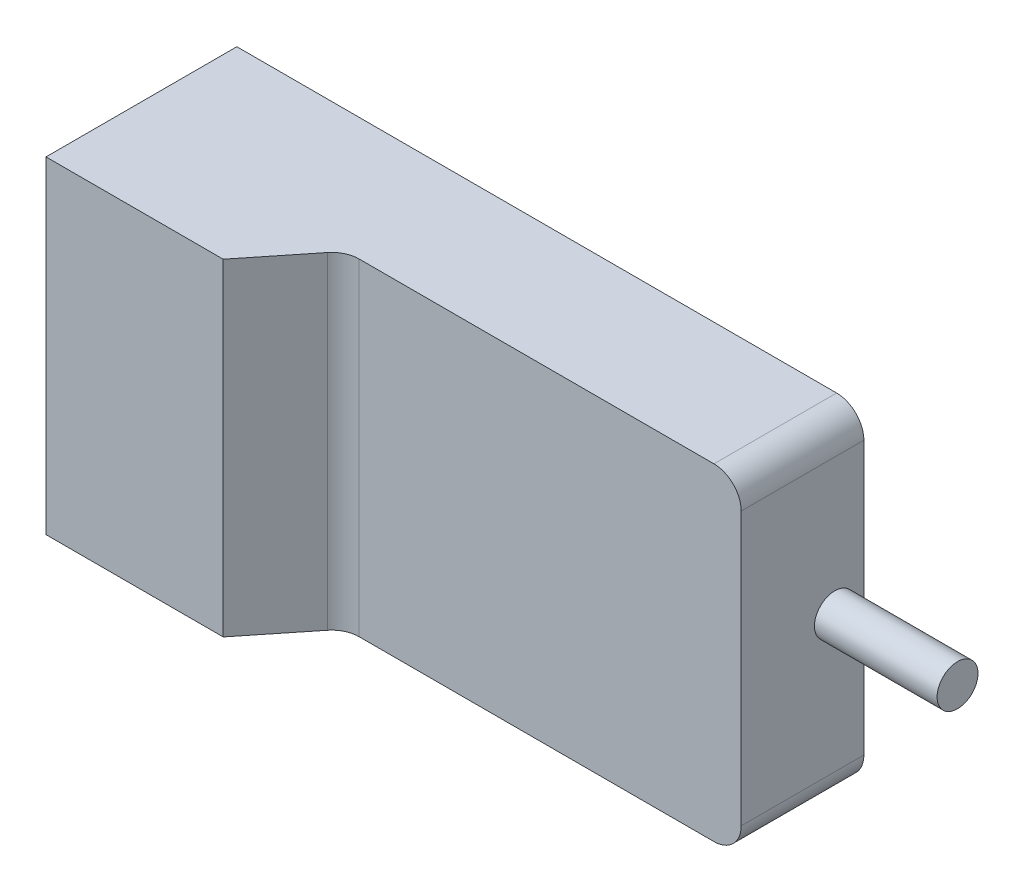
from build123d import *

# Parameters (mm, degrees)
SKETCH_1_W      = 46
SKETCH_1_H      = 24
EXTRUDE_1_DEPTH = 9
SKETCH_4_R      = 1.5
EXTRUDE_2_DEPTH = 9
FILLET_1_R      = 2


with BuildPart() as part:
    # Эскиз1 → Бобышка-Вытянуть1 (new body)
    with BuildSketch(Plane.XY):
        Rectangle(SKETCH_1_W, SKETCH_1_H)
    extrude(amount=EXTRUDE_1_DEPTH)

    # Эскиз2 → По сечениям1 section 0
    with BuildSketch(Plane.XY.offset(9)):
        with BuildLine():
            Line((-23, 12), (-6, 12))
            Line((-6, 12), (-6, -12))
            Line((-6, -12), (-23, -12))
            Line((-23, -12), (-23, 12))
        make_face()
    # Эскиз3 → По сечениям1 section 1
    with BuildSketch(Plane.XY.offset(14)):
        with BuildLine():
            Line((-23, 12), (-10, 12))
            Line((-10, 12), (-10, -12))
            Line((-10, -12), (-23, -12))
            Line((-23, -12), (-23, 12))
        make_face()
    loft()

    # Эскиз4 → Бобышка-Вытянуть2 (add)
    with BuildSketch(Plane(origin=(23, 0, 0), x_dir=(0, 0, -1), z_dir=(1, 0, 0))):
        with Locations(Location((-2.128573829, 0, 0), (0, 0, 270))):
            Circle(SKETCH_4_R)
    extrude(amount=EXTRUDE_2_DEPTH)

    # Скругление1
    fillet_1_edges = [part.edges().sort_by_distance(p)[0] for p in [
        (-6, 0, 9),
        (23, -12, 4.5),
        (23, 12, 4.5),
    ]]
    fillet(fillet_1_edges, radius=FILLET_1_R)


solid = part.part
